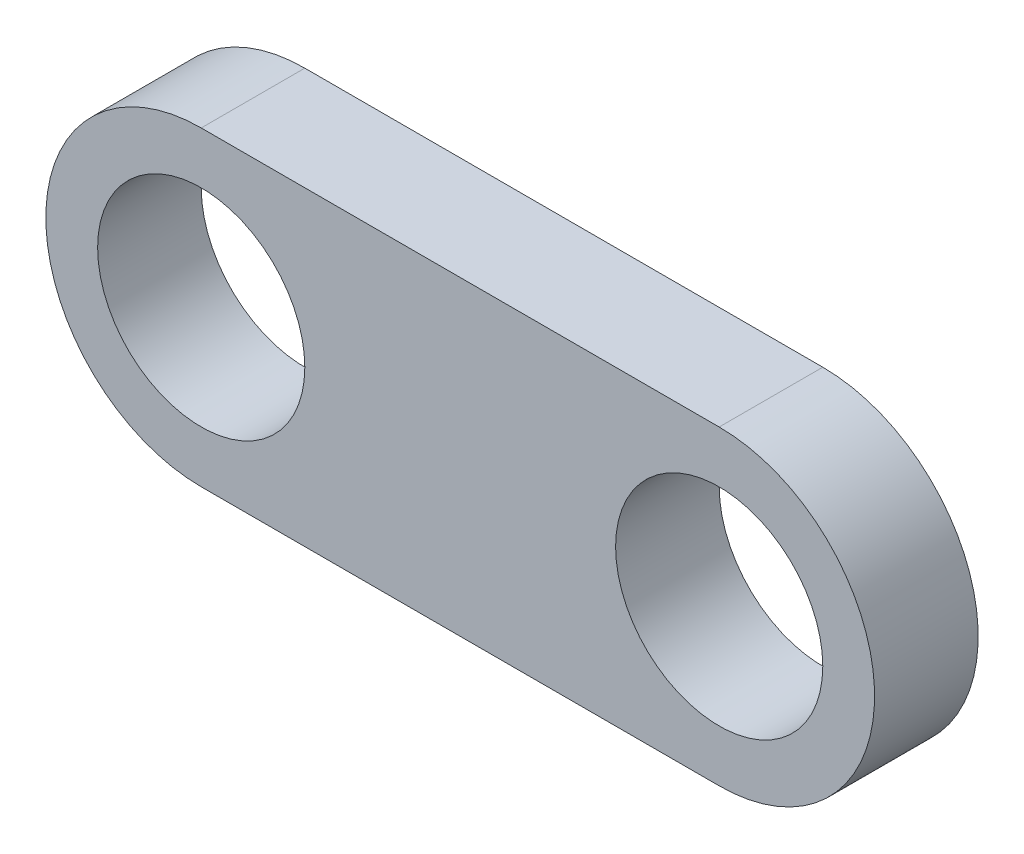
from build123d import *

# Parameters (mm, degrees)
ESQUISSE1_R        = 10
BOSS_EXTRU_1_DEPTH = 5


with BuildPart() as part:
    # Esquisse1 → Boss.-Extru.1 (new, symmetric)
    with BuildSketch(Plane.XY):
        with BuildLine():
            Line((0, -15), (-50, -15))
            ThreePointArc((-50, -15), (-65, 0), (-50, 15))
            Line((-50, 15), (0, 15))
            ThreePointArc((0, 15), (15, 0), (0, -15))
        make_face()
        with Locations((-50, 0)):
            Circle(ESQUISSE1_R, mode=Mode.SUBTRACT)
        Circle(ESQUISSE1_R, mode=Mode.SUBTRACT)
    extrude(amount=BOSS_EXTRU_1_DEPTH, both=True)


solid = part.part
